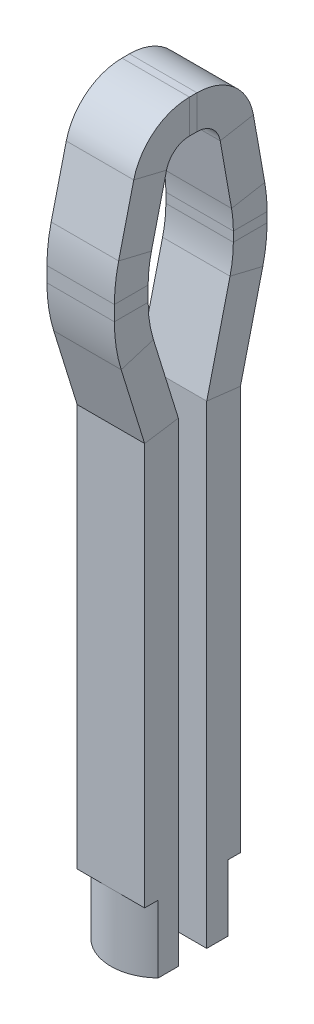
from build123d import *

# Parameters (mm, degrees)
CROQUIS1_W              = 5
CROQUIS1_H              = 2.5
SALIENTE_EXTRUIR1_DEPTH = 5
CROQUIS2_W              = 5
CROQUIS2_H              = 2.5
CROQUIS3_R              = 5.920836197
CROQUIS3_R_2            = 3.60179698
CORTAR_EXTRUIR1_DEPTH   = 5


with BuildPart() as part:
    # Croquis1 → Saliente-Extruir1 (new body)
    with BuildSketch(Plane(origin=(0, 0, 0), x_dir=(1, 0, 0), z_dir=(0, 1, 0))):
        with Locations((2.5, -1.25)):
            Rectangle(CROQUIS1_W, CROQUIS1_H)
    extrude(amount=SALIENTE_EXTRUIR1_DEPTH)

    # Barrer1: sweep along a curve in space
    with BuildLine() as barrer1_path:
        Line((2.5, 5, 1.25), (2.5, 35, 1.25))
        Line((2.5, 35, 1.25), (2.5, 40.786690732, 3.042424523))
        ThreePointArc((2.5, 40.786690732, 3.042424523), (2.5, 42.249249584, 3.377603579), (2.5, 43.745495261, 3.490174748))
        Line((2.5, 43.745495261, 3.490174748), (2.5, 44.85405472, 3.490174748))
        ThreePointArc((2.5, 44.85405472, 3.490174748), (2.5, 46.035691189, 3.420116101), (2.5, 47.200770887, 3.2109218))
        Line((2.5, 47.200770887, 3.2109218), (2.5, 51.840205401, 2.090901298))
        ThreePointArc((2.5, 51.840205401, 2.090901298), (2.5, 53.493312159, 1.030472895), (2.5, 54.136190551, -0.825322817))
        Line((2.5, 54.136190551, -0.825322817), (2.5, 54.136190551, -1.378271143))
        ThreePointArc((2.5, 54.136190551, -1.378271143), (2.5, 53.43445816, -3.306473933), (2.5, 51.657546553, -4.33262182))
        Line((2.5, 51.657546553, -4.33262182), (2.5, 46.898351702, -5.172479734))
        ThreePointArc((2.5, 46.898351702, -5.172479734), (2.5, 46.032749508, -5.28653041), (2.5, 45.160498363, -5.324644146))
        Line((2.5, 45.160498363, -5.324644146), (2.5, 44.439340414, -5.324644146))
        ThreePointArc((2.5, 44.439340414, -5.324644146), (2.5, 43.257703945, -5.254585498), (2.5, 42.092624247, -5.045391197))
        Line((2.5, 42.092624247, -5.045391197), (2.5, 35.083797871, -3.353368343))
        Line((2.5, 35.083797871, -3.353368343), (2.5, 0.100918739, -3.353368343))
    # Croquis2 → Barrer1 (sweep)
    with BuildSketch(Plane(origin=(0, 5, 0), x_dir=(1, 0, 0), z_dir=(0, 1, 0))):
        with Locations((2.5, -1.25)):
            Rectangle(CROQUIS2_W, CROQUIS2_H)
    sweep(path=barrer1_path.line, transition=Transition.RIGHT)

    # Croquis3 → Cortar-Extruir1 (cut)
    with BuildSketch(Plane.XZ):
        with Locations((2.5, -1.10179698)):
            Circle(CROQUIS3_R)
        with Locations((2.5, -1.10179698)):
            Circle(CROQUIS3_R_2, mode=Mode.SUBTRACT)
    extrude(amount=-CORTAR_EXTRUIR1_DEPTH, mode=Mode.SUBTRACT)


solid = part.part
